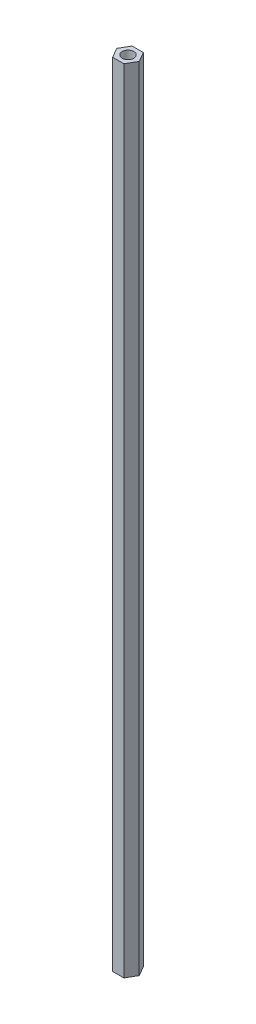
from build123d import *

# Parameters (mm, degrees)
BOSS_EXTRUDE1_DEPTH = 203.2
SKETCH2_R           = 1.5
CUT_EXTRUDE1_DEPTH  = 204.235881018


with BuildPart() as part:
    # Sketch1 → Boss-Extrude1 (new body)
    with BuildSketch(Plane(origin=(0, 0, 0), x_dir=(1, 0, 0), z_dir=(0, 1, 0))):
        Polygon((2.886751346, 0), (1.443375673, 2.5), (-1.443375673, 2.5), (-2.886751346, 0), (-1.443375673, -2.5), (1.443375673, -2.5), align=None)
    extrude(amount=BOSS_EXTRUDE1_DEPTH)

    # Sketch2 → Cut-Extrude1 (cut, through all)
    with BuildSketch(Plane(origin=(0, 203.2, 0), x_dir=(1, 0, 0), z_dir=(0, 1, 0))):
        with Locations(Location((0, 0, 0), (0, 0, 270))):
            Circle(SKETCH2_R)
    extrude(amount=-CUT_EXTRUDE1_DEPTH, mode=Mode.SUBTRACT)


solid = part.part
